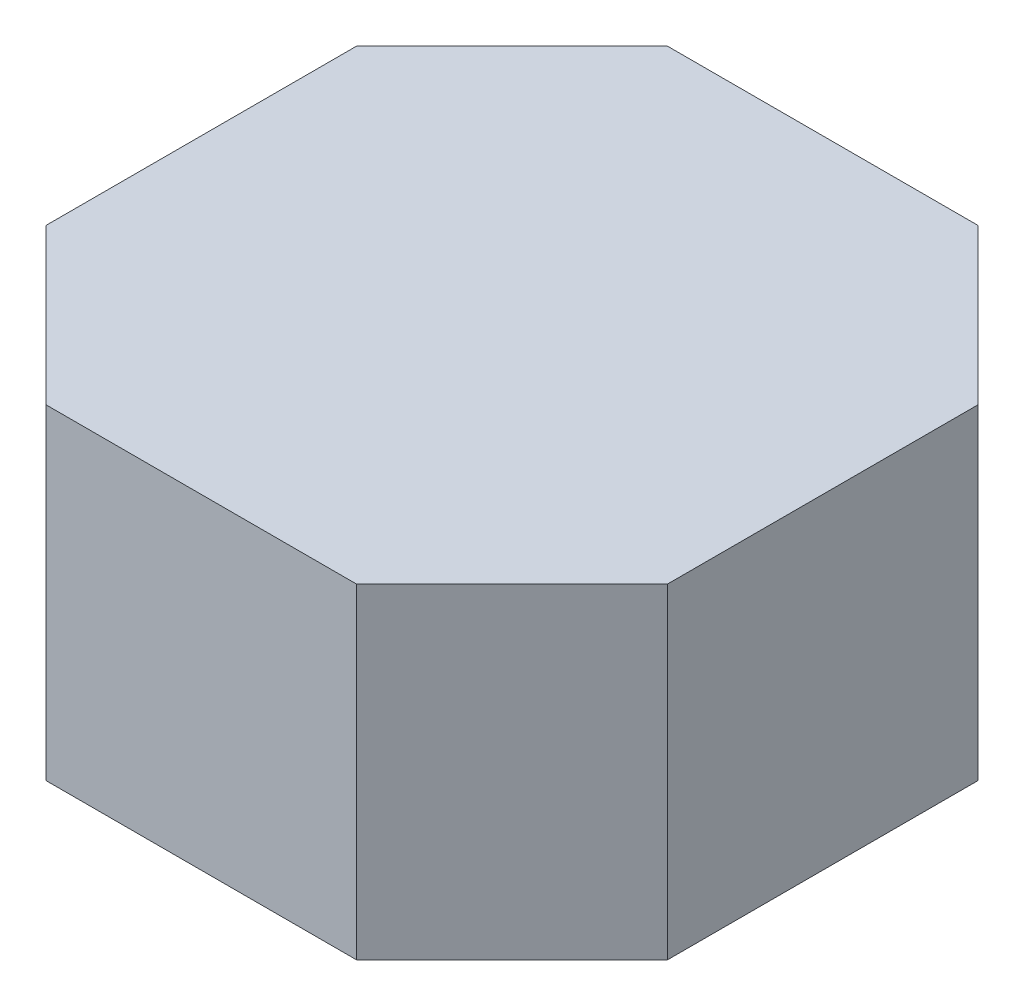
from build123d import *

# Parameters (mm, degrees)
SKETCH1_W     = 42
SKETCH1_H     = 42
NEMA_17_DEPTH = 22
CHAMFER1_SIZE = 10.5


with BuildPart() as part:
    # Sketch1 → Nema 17 (new body)
    with BuildSketch(Plane(origin=(0, 0, 0), x_dir=(1, 0, 0), z_dir=(0, 1, 0))):
        Rectangle(SKETCH1_W, SKETCH1_H)
    extrude(amount=NEMA_17_DEPTH)

    # Chamfer1
    chamfer1_edges = [part.edges().sort_by_distance(p)[0] for p in [
        (21, 11, 21),
        (-21, 11, 21),
        (-21, 11, -21),
        (21, 11, -21),
    ]]
    chamfer(chamfer1_edges, length=CHAMFER1_SIZE)


solid = part.part
